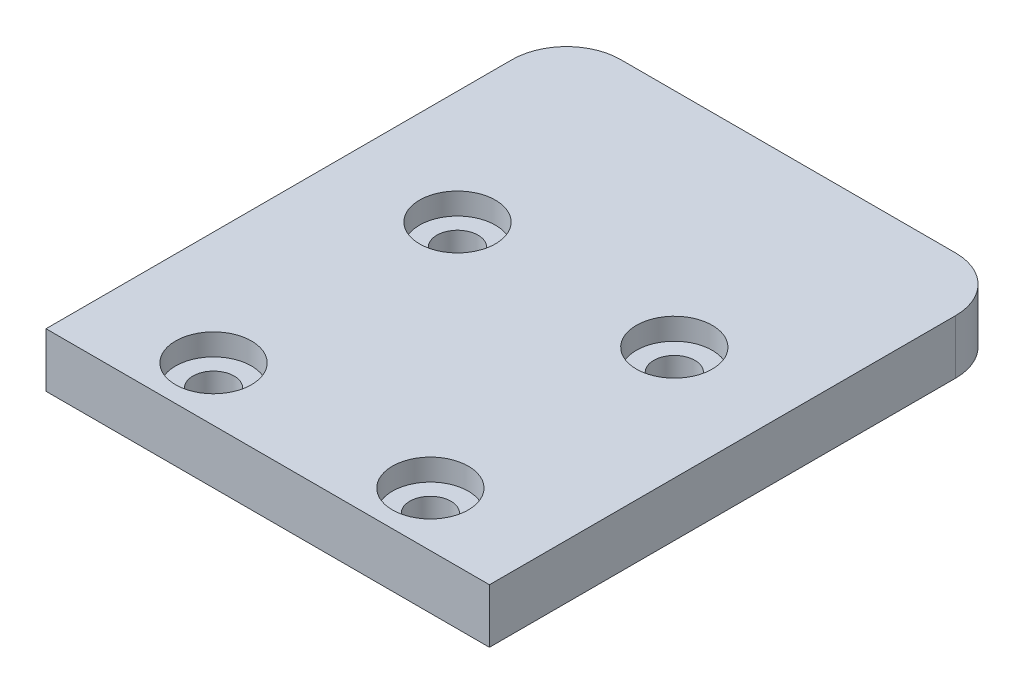
from build123d import *

# Parameters (mm, degrees)
BOSS_EXTRU_1_DEPTH      = 9
BOSS_EXTRU_1_DEPTH_BACK = 9
ESQUISSE1_R             = 2
ESQUISSE2_W             = 40.9
ESQUISSE2_H             = 7
ESQUISSE2_H_2           = 23
BOSS_EXTRU_2_DEPTH      = 5
ESQUISSE5_W             = 8
ESQUISSE5_H             = 18
ENL_V_MAT_EXTRU_2_DEPTH = 64.562646263
ESQUISSE6_R             = 1.9
ENL_V_MAT_EXTRU_3_DEPTH = 10
CONG_1_R                = 5
ESQUISSE7_R             = 3.5
ENL_V_MAT_EXTRU_4_DEPTH = 2


with BuildPart() as part:
    # Esquisse1 → Boss.-Extru.1 (new, two sides: drawn at the far end of the back side and taken through both)
    with BuildSketch(Plane.XY.offset(-BOSS_EXTRU_1_DEPTH_BACK)):
        Polygon((0, 25), (-8, 25), (-8, 0), (48.9, 0), (48.9, 25), (40.9, 25), (40.9, 5), (0, 5), align=None)
        with Locations((-3.85, 10)):
            Circle(ESQUISSE1_R, mode=Mode.SUBTRACT)
        with Locations((-3.85, 20)):
            Circle(ESQUISSE1_R, mode=Mode.SUBTRACT)
        with Locations((44.75, 20)):
            Circle(ESQUISSE1_R, mode=Mode.SUBTRACT)
        with Locations((44.75, 10)):
            Circle(ESQUISSE1_R, mode=Mode.SUBTRACT)
    extrude(amount=BOSS_EXTRU_1_DEPTH + BOSS_EXTRU_1_DEPTH_BACK)

    # Esquisse2 → Boss.-Extru.2 (add)
    with BuildSketch(Plane(origin=(0, 5, 0), x_dir=(1, 0, 0), z_dir=(0, 1, 0))):
        with Locations((20.45, 12.5)):
            Rectangle(ESQUISSE2_W, ESQUISSE2_H)
        with Locations((20.45, -20.5)):
            Rectangle(ESQUISSE2_W, ESQUISSE2_H_2)
    extrude(amount=-BOSS_EXTRU_2_DEPTH)

    # Esquisse5 → Enlèv. mat.-Extru.2 (cut, through all)
    with BuildSketch(Plane(origin=(0, 25, 0), x_dir=(1, 0, 0), z_dir=(0, 1, 0))):
        with Locations((-4, 0)):
            Rectangle(ESQUISSE5_W, ESQUISSE5_H)
        with Locations((44.9, 0)):
            Rectangle(ESQUISSE5_W, ESQUISSE5_H)
    extrude(amount=-ENL_V_MAT_EXTRU_2_DEPTH, mode=Mode.SUBTRACT)

    # Esquisse6 → Enlèv. mat.-Extru.3 (cut)
    with BuildSketch(Plane(origin=(0, 5, 0), x_dir=(1, 0, 0), z_dir=(0, 1, 0))):
        with Locations((10.45, -4.5)):
            Circle(ESQUISSE6_R)
        with Locations((30.45, -4.5)):
            Circle(ESQUISSE6_R)
        with Locations((10.45, -27)):
            Circle(ESQUISSE6_R)
        with Locations((30.45, -27)):
            Circle(ESQUISSE6_R)
    extrude(amount=-ENL_V_MAT_EXTRU_3_DEPTH, mode=Mode.SUBTRACT)

    # Congé1
    cong_1_edges = [part.edges().sort_by_distance(p)[0] for p in [
        (40.9, 2.5, -16),
        (0, 2.5, -16),
    ]]
    fillet(cong_1_edges, radius=CONG_1_R)

    # Esquisse7 → Enlèv. mat.-Extru.4 (cut)
    with BuildSketch(Plane(origin=(0, 5, 0), x_dir=(1, 0, 0), z_dir=(0, 1, 0))):
        with Locations((10.45, -4.5)):
            Circle(ESQUISSE7_R)
        with Locations((30.45, -4.5)):
            Circle(ESQUISSE7_R)
        with Locations((30.45, -27)):
            Circle(ESQUISSE7_R)
        with Locations((10.45, -27)):
            Circle(ESQUISSE7_R)
    extrude(amount=-ENL_V_MAT_EXTRU_4_DEPTH, mode=Mode.SUBTRACT)


solid = part.part
